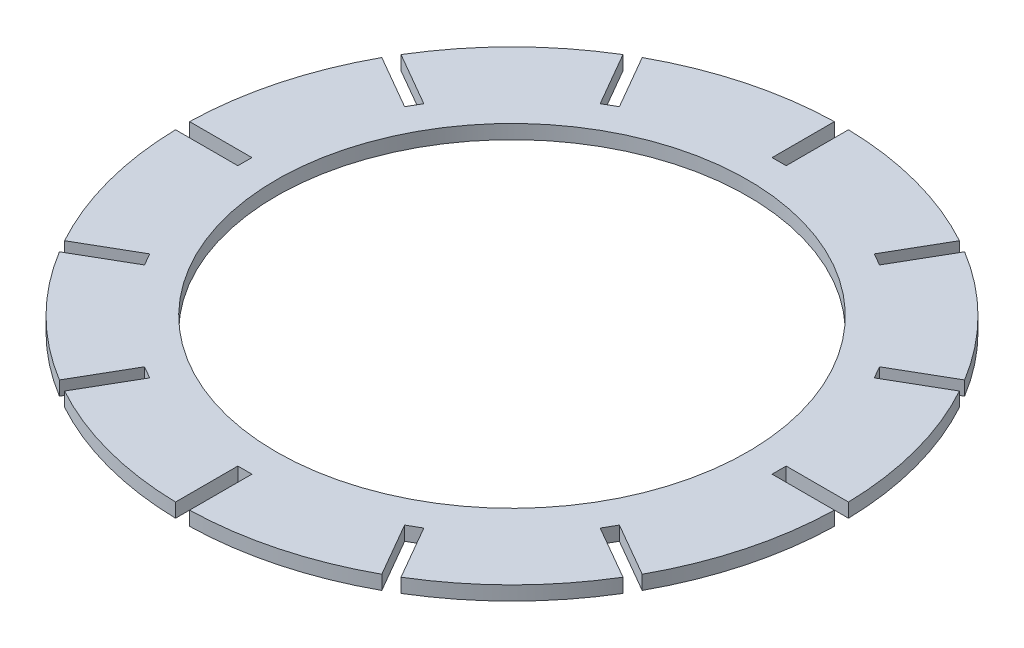
from build123d import *

# Parameters (mm, degrees)
SKETCH1_R           = 70.25
SKETCH1_R_2         = 50.25
BOSS_EXTRUDE1_DEPTH = 3
SKETCH2_W           = 13.3
SKETCH2_H           = 3
CUT_EXTRUDE1_DEPTH  = 3
CIRPATTERN1_COUNT   = 12


with BuildPart() as part:
    # Sketch1 → Boss-Extrude1 (new body)
    with BuildSketch(Plane(origin=(0, 0, 0), x_dir=(1, 0, 0), z_dir=(0, 1, 0))):
        with Locations(Location((0, 0, 0), (0, 0, 270))):
            Circle(SKETCH1_R)
        with Locations(Location((0, 0, 0), (0, 0, 270))):
            Circle(SKETCH1_R_2, mode=Mode.SUBTRACT)
    extrude(amount=BOSS_EXTRUDE1_DEPTH)

    # Sketch2 → Cut-Extrude1 (cut)
    with BuildSketch(Plane(origin=(0, 3, 0), x_dir=(1, 0, 0), z_dir=(0, 1, 0))):
        with Locations((-63.6, 0)):
            Rectangle(SKETCH2_W, SKETCH2_H)
    cut_extrude1 = extrude(amount=-CUT_EXTRUDE1_DEPTH, mode=Mode.SUBTRACT)

    # CirPattern1: Cut-Extrude1 ×12 about axis
    cirpattern1_axis = Axis((0, 0, 0), (0, 1, 0))
    for i in range(1, CIRPATTERN1_COUNT):
        add(cut_extrude1.rotate(cirpattern1_axis, i * 360 / CIRPATTERN1_COUNT), mode=Mode.SUBTRACT)


solid = part.part
